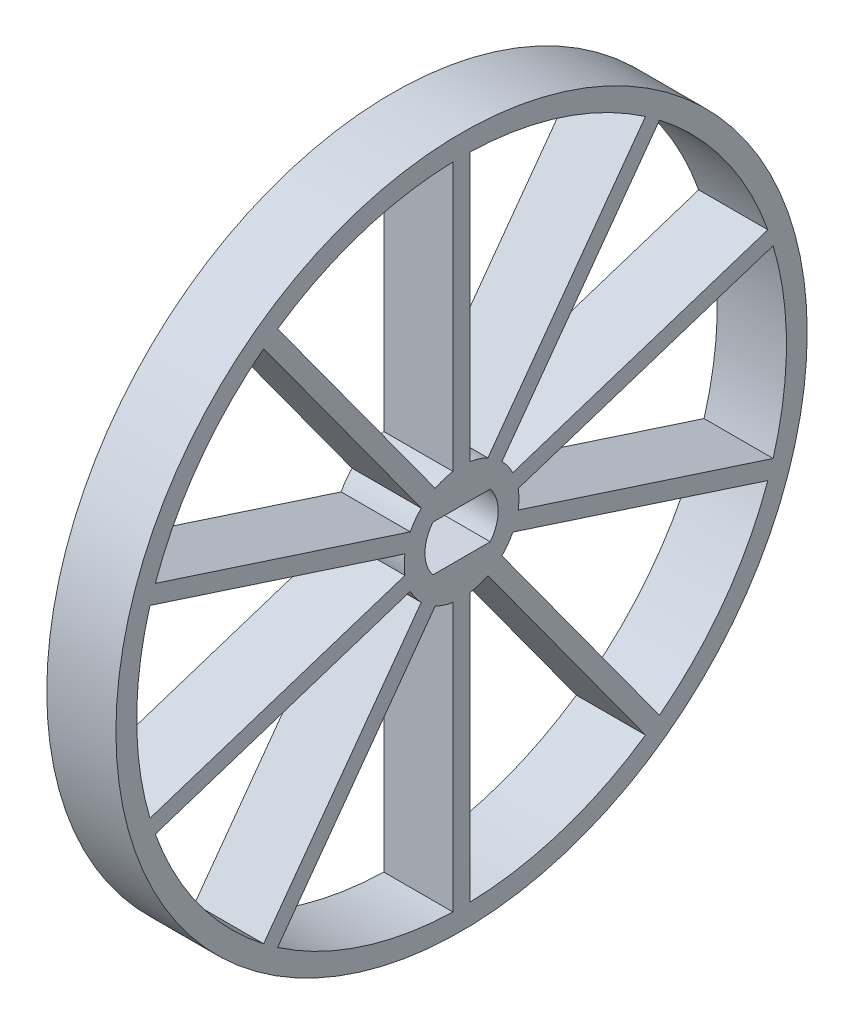
from build123d import *

# Parameters (mm, degrees)
SKETCH1_R           = 25
BOSS_EXTRUDE2_DEPTH = 5


with BuildPart() as part:
    # Sketch1 → Boss-Extrude2 (new body)
    # profile 1 of 38: a face of its own
    with BuildSketch(Plane(origin=(0, 0, 0), x_dir=(0, 0, -1), z_dir=(1, 0, 0))):
        Circle(SKETCH1_R)
        with BuildLine():
            ThreePointArc((-13.30243176, 19.372540083), (-7.261899368, 22.349828133), (-0.625, 23.49168736))
            Line((-0.625, 23.49168736), (-0.625, 23.832616044))
            Line((-0.625, 23.832616044), (0.625, 23.832616044))
            Line((0.625, 23.832616044), (0.625, 23.49168736))
            ThreePointArc((0.625, 23.49168736), (7.261899368, 22.349828133), (13.30243176, 19.372540083))
            Line((13.30243176, 19.372540083), (13.502824613, 19.648357183))
            Line((13.502824613, 19.648357183), (14.514095856, 18.913625618))
            Line((14.514095856, 18.913625618), (14.313703003, 18.637808518))
            ThreePointArc((14.313703003, 18.637808518), (19.011899368, 13.812953429), (22.148786721, 7.853740943))
            Line((22.148786721, 7.853740943), (22.473029168, 7.959093701))
            Line((22.473029168, 7.959093701), (22.859300411, 6.770273055))
            Line((22.859300411, 6.770273055), (22.535057964, 6.664920298))
            ThreePointArc((22.535057964, 6.664920298), (23.257513433, 3.367204913), (23.5, 0))
            ThreePointArc((23.5, 0), (23.257513433, -3.367204913), (22.535057964, -6.664920298))
            Line((22.535057964, -6.664920298), (22.859300411, -6.770273055))
            Line((22.859300411, -6.770273055), (22.473029168, -7.959093701))
            Line((22.473029168, -7.959093701), (22.148786721, -7.853740943))
            ThreePointArc((22.148786721, -7.853740943), (19.011899368, -13.812953429), (14.313703003, -18.637808518))
            Line((14.313703003, -18.637808518), (14.514095856, -18.913625618))
            Line((14.514095856, -18.913625618), (13.502824613, -19.648357183))
            Line((13.502824613, -19.648357183), (13.30243176, -19.372540083))
            ThreePointArc((13.30243176, -19.372540083), (7.261899368, -22.349828133), (0.625, -23.49168736))
            Line((0.625, -23.49168736), (0.625, -23.832616044))
            Line((0.625, -23.832616044), (-0.625, -23.832616044))
            Line((-0.625, -23.832616044), (-0.625, -23.49168736))
            ThreePointArc((-0.625, -23.49168736), (-7.261899368, -22.349828133), (-13.30243176, -19.372540083))
            Line((-13.30243176, -19.372540083), (-13.502824613, -19.648357183))
            Line((-13.502824613, -19.648357183), (-14.514095856, -18.913625618))
            Line((-14.514095856, -18.913625618), (-14.313703003, -18.637808518))
            ThreePointArc((-14.313703003, -18.637808518), (-19.011899368, -13.812953429), (-22.148786721, -7.853740943))
            Line((-22.148786721, -7.853740943), (-22.473029168, -7.959093701))
            Line((-22.473029168, -7.959093701), (-22.859300411, -6.770273055))
            Line((-22.859300411, -6.770273055), (-22.535057964, -6.664920298))
            ThreePointArc((-22.535057964, -6.664920298), (-23.5, 0), (-22.535057964, 6.664920298))
            Line((-22.535057964, 6.664920298), (-22.859300411, 6.770273055))
            Line((-22.859300411, 6.770273055), (-22.473029168, 7.959093701))
            Line((-22.473029168, 7.959093701), (-22.148786721, 7.853740943))
            ThreePointArc((-22.148786721, 7.853740943), (-19.011899368, 13.812953429), (-14.313703003, 18.637808518))
            Line((-14.313703003, 18.637808518), (-14.514095856, 18.913625618))
            Line((-14.514095856, 18.913625618), (-13.502824613, 19.648357183))
            Line((-13.502824613, 19.648357183), (-13.30243176, 19.372540083))
        make_face(mode=Mode.SUBTRACT)
    # profile 2 of 38: a face of its own
    with BuildSketch(Plane(origin=(0, 0, 0), x_dir=(0, 0, -1), z_dir=(1, 0, 0))):
        with BuildLine():
            Line((-0.625, 23.49168736), (-0.625, 4.102666816))
            ThreePointArc((-0.625, 4.102666816), (0, 4.15), (0.625, 4.102666816))
            Line((0.625, 4.102666816), (0.625, 23.49168736))
            ThreePointArc((0.625, 23.49168736), (0, 23.5), (-0.625, 23.49168736))
        make_face()
    # profile 3 of 38: a face of its own
    with BuildSketch(Plane(origin=(0, 0, 0), x_dir=(0, 0, -1), z_dir=(1, 0, 0))):
        with BuildLine():
            Line((-0.625, 23.832616044), (-0.625, 23.49168736))
            ThreePointArc((-0.625, 23.49168736), (0, 23.5), (0.625, 23.49168736))
            Line((0.625, 23.49168736), (0.625, 23.832616044))
            Line((0.625, 23.832616044), (-0.625, 23.832616044))
        make_face()
    # profile 4 of 38: a face of its own
    with BuildSketch(Plane(origin=(0, 0, 0), x_dir=(0, 0, -1), z_dir=(1, 0, 0))):
        with BuildLine():
            ThreePointArc((-14.313703003, 18.637808518), (-13.812953429, 19.011899368), (-13.30243176, 19.372540083))
            Line((-13.30243176, 19.372540083), (-13.502824613, 19.648357183))
            Line((-13.502824613, 19.648357183), (-14.514095856, 18.913625618))
            Line((-14.514095856, 18.913625618), (-14.313703003, 18.637808518))
        make_face()
    # profile 5 of 38: a face of its own
    with BuildSketch(Plane(origin=(0, 0, 0), x_dir=(0, 0, -1), z_dir=(1, 0, 0))):
        with BuildLine():
            ThreePointArc((-2.917122671, 2.951761393), (-2.439308797, 3.357420527), (-1.905851428, 3.686492959))
            Line((-1.905851428, 3.686492959), (-13.30243176, 19.372540083))
            ThreePointArc((-13.30243176, 19.372540083), (-13.812953429, 19.011899368), (-14.313703003, 18.637808518))
            Line((-14.313703003, 18.637808518), (-2.917122671, 2.951761393))
        make_face()
    # profile 6 of 38: a face of its own
    with BuildSketch(Plane(origin=(0, 0, 0), x_dir=(0, 0, -1), z_dir=(1, 0, 0))):
        with BuildLine():
            ThreePointArc((-22.535057964, 6.664920298), (-22.349828133, 7.261899368), (-22.148786721, 7.853740943))
            Line((-22.148786721, 7.853740943), (-22.473029168, 7.959093701))
            Line((-22.473029168, 7.959093701), (-22.859300411, 6.770273055))
            Line((-22.859300411, 6.770273055), (-22.535057964, 6.664920298))
        make_face()
    # profile 7 of 38: a face of its own
    with BuildSketch(Plane(origin=(0, 0, 0), x_dir=(0, 0, -1), z_dir=(1, 0, 0))):
        with BuildLine():
            ThreePointArc((-4.095003631, 0.673383446), (-3.946884543, 1.282420527), (-3.708732388, 1.862204091))
            Line((-3.708732388, 1.862204091), (-22.148786721, 7.853740943))
            ThreePointArc((-22.148786721, 7.853740943), (-22.349828133, 7.261899368), (-22.535057964, 6.664920298))
            Line((-22.535057964, 6.664920298), (-4.095003631, 0.673383446))
        make_face()
    # profile 8 of 38: a face of its own
    with BuildSketch(Plane(origin=(0, 0, 0), x_dir=(0, 0, -1), z_dir=(1, 0, 0))):
        with BuildLine():
            ThreePointArc((-22.148786721, -7.853740943), (-22.349828133, -7.261899368), (-22.535057964, -6.664920298))
            Line((-22.535057964, -6.664920298), (-22.859300411, -6.770273055))
            Line((-22.859300411, -6.770273055), (-22.473029168, -7.959093701))
            Line((-22.473029168, -7.959093701), (-22.148786721, -7.853740943))
        make_face()
    # profile 9 of 38: a face of its own
    with BuildSketch(Plane(origin=(0, 0, 0), x_dir=(0, 0, -1), z_dir=(1, 0, 0))):
        with BuildLine():
            ThreePointArc((-13.30243176, -19.372540083), (-13.812953429, -19.011899368), (-14.313703003, -18.637808518))
            Line((-14.313703003, -18.637808518), (-14.514095856, -18.913625618))
            Line((-14.514095856, -18.913625618), (-13.502824613, -19.648357183))
            Line((-13.502824613, -19.648357183), (-13.30243176, -19.372540083))
        make_face()
    # profile 10 of 38: a face of its own
    with BuildSketch(Plane(origin=(0, 0, 0), x_dir=(0, 0, -1), z_dir=(1, 0, 0))):
        with BuildLine():
            ThreePointArc((-1.905851428, -3.686492959), (-2.439308797, -3.357420527), (-2.917122671, -2.951761393))
            Line((-2.917122671, -2.951761393), (-14.313703003, -18.637808518))
            ThreePointArc((-14.313703003, -18.637808518), (-13.812953429, -19.011899368), (-13.30243176, -19.372540083))
            Line((-13.30243176, -19.372540083), (-1.905851428, -3.686492959))
        make_face()
    # profile 11 of 38: a face of its own
    with BuildSketch(Plane(origin=(0, 0, 0), x_dir=(0, 0, -1), z_dir=(1, 0, 0))):
        with BuildLine():
            ThreePointArc((-3.708732388, -1.862204091), (-3.946884543, -1.282420527), (-4.095003631, -0.673383446))
            Line((-4.095003631, -0.673383446), (-22.535057964, -6.664920298))
            ThreePointArc((-22.535057964, -6.664920298), (-22.349828133, -7.261899368), (-22.148786721, -7.853740943))
            Line((-22.148786721, -7.853740943), (-3.708732388, -1.862204091))
        make_face()
    # profile 12 of 38: a face of its own
    with BuildSketch(Plane(origin=(0, 0, 0), x_dir=(0, 0, -1), z_dir=(1, 0, 0))):
        with BuildLine():
            ThreePointArc((0.625, -23.49168736), (0, -23.5), (-0.625, -23.49168736))
            Line((-0.625, -23.49168736), (-0.625, -23.832616044))
            Line((-0.625, -23.832616044), (0.625, -23.832616044))
            Line((0.625, -23.832616044), (0.625, -23.49168736))
        make_face()
    # profile 13 of 38: a face of its own
    with BuildSketch(Plane(origin=(0, 0, 0), x_dir=(0, 0, -1), z_dir=(1, 0, 0))):
        with BuildLine():
            ThreePointArc((0.625, -4.102666816), (0, -4.15), (-0.625, -4.102666816))
            Line((-0.625, -4.102666816), (-0.625, -23.49168736))
            ThreePointArc((-0.625, -23.49168736), (0, -23.5), (0.625, -23.49168736))
            Line((0.625, -23.49168736), (0.625, -4.102666816))
        make_face()
    # profile 14 of 38: a face of its own
    with BuildSketch(Plane(origin=(0, 0, 0), x_dir=(0, 0, -1), z_dir=(1, 0, 0))):
        with BuildLine():
            Line((14.514095856, -18.913625618), (14.313703003, -18.637808518))
            ThreePointArc((14.313703003, -18.637808518), (13.812953429, -19.011899368), (13.30243176, -19.372540083))
            Line((13.30243176, -19.372540083), (13.502824613, -19.648357183))
            Line((13.502824613, -19.648357183), (14.514095856, -18.913625618))
        make_face()
    # profile 15 of 38: a face of its own
    with BuildSketch(Plane(origin=(0, 0, 0), x_dir=(0, 0, -1), z_dir=(1, 0, 0))):
        with BuildLine():
            Line((14.313703003, -18.637808518), (2.917122671, -2.951761393))
            ThreePointArc((2.917122671, -2.951761393), (2.439308797, -3.357420527), (1.905851428, -3.686492959))
            Line((1.905851428, -3.686492959), (13.30243176, -19.372540083))
            ThreePointArc((13.30243176, -19.372540083), (13.812953429, -19.011899368), (14.313703003, -18.637808518))
        make_face()
    # profile 16 of 38: a face of its own
    with BuildSketch(Plane(origin=(0, 0, 0), x_dir=(0, 0, -1), z_dir=(1, 0, 0))):
        with BuildLine():
            Line((22.859300411, -6.770273055), (22.535057964, -6.664920298))
            ThreePointArc((22.535057964, -6.664920298), (22.349828133, -7.261899368), (22.148786721, -7.853740943))
            Line((22.148786721, -7.853740943), (22.473029168, -7.959093701))
            Line((22.473029168, -7.959093701), (22.859300411, -6.770273055))
        make_face()
    # profile 17 of 38: a face of its own
    with BuildSketch(Plane(origin=(0, 0, 0), x_dir=(0, 0, -1), z_dir=(1, 0, 0))):
        with BuildLine():
            Line((22.535057964, -6.664920298), (4.095003631, -0.673383446))
            ThreePointArc((4.095003631, -0.673383446), (3.946884543, -1.282420527), (3.708732388, -1.862204091))
            Line((3.708732388, -1.862204091), (22.148786721, -7.853740943))
            ThreePointArc((22.148786721, -7.853740943), (22.349828133, -7.261899368), (22.535057964, -6.664920298))
        make_face()
    # profile 18 of 38: a face of its own
    with BuildSketch(Plane(origin=(0, 0, 0), x_dir=(0, 0, -1), z_dir=(1, 0, 0))):
        with BuildLine():
            Line((22.473029168, 7.959093701), (22.148786721, 7.853740943))
            ThreePointArc((22.148786721, 7.853740943), (22.349828133, 7.261899368), (22.535057964, 6.664920298))
            Line((22.535057964, 6.664920298), (22.859300411, 6.770273055))
            Line((22.859300411, 6.770273055), (22.473029168, 7.959093701))
        make_face()
    # profile 19 of 38: a face of its own
    with BuildSketch(Plane(origin=(0, 0, 0), x_dir=(0, 0, -1), z_dir=(1, 0, 0))):
        with BuildLine():
            Line((22.148786721, 7.853740943), (3.708732388, 1.862204091))
            ThreePointArc((3.708732388, 1.862204091), (3.946884543, 1.282420527), (4.095003631, 0.673383446))
            Line((4.095003631, 0.673383446), (22.535057964, 6.664920298))
            ThreePointArc((22.535057964, 6.664920298), (22.349828133, 7.261899368), (22.148786721, 7.853740943))
        make_face()
    # profile 20 of 38: a face of its own
    with BuildSketch(Plane(origin=(0, 0, 0), x_dir=(0, 0, -1), z_dir=(1, 0, 0))):
        with BuildLine():
            Line((13.502824613, 19.648357183), (13.30243176, 19.372540083))
            ThreePointArc((13.30243176, 19.372540083), (13.812953429, 19.011899368), (14.313703003, 18.637808518))
            Line((14.313703003, 18.637808518), (14.514095856, 18.913625618))
            Line((14.514095856, 18.913625618), (13.502824613, 19.648357183))
        make_face()
    # profile 21 of 38: a face of its own
    with BuildSketch(Plane(origin=(0, 0, 0), x_dir=(0, 0, -1), z_dir=(1, 0, 0))):
        with BuildLine():
            Line((13.30243176, 19.372540083), (1.905851428, 3.686492959))
            ThreePointArc((1.905851428, 3.686492959), (2.439308797, 3.357420527), (2.917122671, 2.951761393))
            Line((2.917122671, 2.951761393), (14.313703003, 18.637808518))
            ThreePointArc((14.313703003, 18.637808518), (13.812953429, 19.011899368), (13.30243176, 19.372540083))
        make_face()
    # profile 22 of 38: a face of its own
    with BuildSketch(Plane(origin=(0, 0, 0), x_dir=(0, 0, -1), z_dir=(1, 0, 0))):
        with BuildLine():
            Line((-3.838170085, -0.589933168), (-4.095003631, -0.673383446))
            ThreePointArc((-4.095003631, -0.673383446), (-3.946884543, -1.282420527), (-3.708732388, -1.862204091))
            Line((-3.708732388, -1.862204091), (-3.451898842, -1.778753813))
            Line((-3.451898842, -1.778753813), (-3.838170085, -0.589933168))
        make_face()
    # profile 23 of 38: a face of its own
    with BuildSketch(Plane(origin=(0, 0, 0), x_dir=(0, 0, -1), z_dir=(1, 0, 0))):
        with BuildLine():
            Line((-2.75839081, -2.73328573), (-2.917122671, -2.951761393))
            ThreePointArc((-2.917122671, -2.951761393), (-2.439308797, -3.357420527), (-1.905851428, -3.686492959))
            Line((-1.905851428, -3.686492959), (-1.747119567, -3.468017295))
            Line((-1.747119567, -3.468017295), (-2.75839081, -2.73328573))
        make_face()
    # profile 24 of 38: a face of its own
    with BuildSketch(Plane(origin=(0, 0, 0), x_dir=(0, 0, -1), z_dir=(1, 0, 0))):
        with BuildLine():
            Line((-0.625, -3.832616044), (-0.625, -4.102666816))
            ThreePointArc((-0.625, -4.102666816), (0, -4.15), (0.625, -4.102666816))
            Line((0.625, -4.102666816), (0.625, -3.832616044))
            Line((0.625, -3.832616044), (-0.625, -3.832616044))
        make_face()
    # profile 25 of 38: a face of its own
    with BuildSketch(Plane(origin=(0, 0, 0), x_dir=(0, 0, -1), z_dir=(1, 0, 0))):
        with BuildLine():
            ThreePointArc((1.905851428, -3.686492959), (2.439308797, -3.357420527), (2.917122671, -2.951761393))
            Line((2.917122671, -2.951761393), (2.75839081, -2.73328573))
            Line((2.75839081, -2.73328573), (1.747119567, -3.468017295))
            Line((1.747119567, -3.468017295), (1.905851428, -3.686492959))
        make_face()
    # profile 26 of 38: a face of its own
    with BuildSketch(Plane(origin=(0, 0, 0), x_dir=(0, 0, -1), z_dir=(1, 0, 0))):
        with BuildLine():
            ThreePointArc((3.708732388, -1.862204091), (3.946884543, -1.282420527), (4.095003631, -0.673383446))
            Line((4.095003631, -0.673383446), (3.838170085, -0.589933168))
            Line((3.838170085, -0.589933168), (3.451898842, -1.778753813))
            Line((3.451898842, -1.778753813), (3.708732388, -1.862204091))
        make_face()
    # profile 27 of 38: a face of its own
    with BuildSketch(Plane(origin=(0, 0, 0), x_dir=(0, 0, -1), z_dir=(1, 0, 0))):
        with BuildLine():
            ThreePointArc((4.095003631, 0.673383446), (3.946884543, 1.282420527), (3.708732388, 1.862204091))
            Line((3.708732388, 1.862204091), (3.451898842, 1.778753813))
            Line((3.451898842, 1.778753813), (3.838170085, 0.589933168))
            Line((3.838170085, 0.589933168), (4.095003631, 0.673383446))
        make_face()
    # profile 28 of 38: a face of its own
    with BuildSketch(Plane(origin=(0, 0, 0), x_dir=(0, 0, -1), z_dir=(1, 0, 0))):
        with BuildLine():
            ThreePointArc((2.917122671, 2.951761393), (2.439308797, 3.357420527), (1.905851428, 3.686492959))
            Line((1.905851428, 3.686492959), (1.747119567, 3.468017295))
            Line((1.747119567, 3.468017295), (2.75839081, 2.73328573))
            Line((2.75839081, 2.73328573), (2.917122671, 2.951761393))
        make_face()
    # profile 29 of 38: a face of its own
    with BuildSketch(Plane(origin=(0, 0, 0), x_dir=(0, 0, -1), z_dir=(1, 0, 0))):
        with BuildLine():
            Line((-0.625, 4.102666816), (-0.625, 3.832616044))
            Line((-0.625, 3.832616044), (0.625, 3.832616044))
            Line((0.625, 3.832616044), (0.625, 4.102666816))
            ThreePointArc((0.625, 4.102666816), (0, 4.15), (-0.625, 4.102666816))
        make_face()
    # profile 30 of 38: a face of its own
    with BuildSketch(Plane(origin=(0, 0, 0), x_dir=(0, 0, -1), z_dir=(1, 0, 0))):
        with BuildLine():
            Line((-1.747119567, 3.468017295), (-1.905851428, 3.686492959))
            ThreePointArc((-1.905851428, 3.686492959), (-2.439308797, 3.357420527), (-2.917122671, 2.951761393))
            Line((-2.917122671, 2.951761393), (-2.75839081, 2.73328573))
            Line((-2.75839081, 2.73328573), (-1.747119567, 3.468017295))
        make_face()
    # profile 31 of 38: a face of its own
    with BuildSketch(Plane(origin=(0, 0, 0), x_dir=(0, 0, -1), z_dir=(1, 0, 0))):
        with BuildLine():
            Line((-3.451898842, 1.778753813), (-3.708732388, 1.862204091))
            ThreePointArc((-3.708732388, 1.862204091), (-3.946884543, 1.282420527), (-4.095003631, 0.673383446))
            Line((-4.095003631, 0.673383446), (-3.838170085, 0.589933168))
            Line((-3.838170085, 0.589933168), (-3.451898842, 1.778753813))
        make_face()
    # profile 32 of 38: a face of its own
    with BuildSketch(Plane(origin=(0, 0, 0), x_dir=(0, 0, -1), z_dir=(1, 0, 0))):
        with BuildLine():
            Line((0.625, 3.832616044), (-0.625, 3.832616044))
            Line((-0.625, 3.832616044), (-0.625, 4.102666816))
            ThreePointArc((-0.625, 4.102666816), (-1.282420527, 3.946884543), (-1.905851428, 3.686492959))
            Line((-1.905851428, 3.686492959), (-1.747119567, 3.468017295))
            Line((-1.747119567, 3.468017295), (-2.75839081, 2.73328573))
            Line((-2.75839081, 2.73328573), (-2.917122671, 2.951761393))
            ThreePointArc((-2.917122671, 2.951761393), (-3.357420527, 2.439308797), (-3.708732388, 1.862204091))
            Line((-3.708732388, 1.862204091), (-3.451898842, 1.778753813))
            Line((-3.451898842, 1.778753813), (-3.838170085, 0.589933168))
            Line((-3.838170085, 0.589933168), (-4.095003631, 0.673383446))
            ThreePointArc((-4.095003631, 0.673383446), (-4.15, 0), (-4.095003631, -0.673383446))
            Line((-4.095003631, -0.673383446), (-3.838170085, -0.589933168))
            Line((-3.838170085, -0.589933168), (-3.451898842, -1.778753813))
            Line((-3.451898842, -1.778753813), (-3.708732388, -1.862204091))
            ThreePointArc((-3.708732388, -1.862204091), (-3.357420527, -2.439308797), (-2.917122671, -2.951761393))
            Line((-2.917122671, -2.951761393), (-2.75839081, -2.73328573))
            Line((-2.75839081, -2.73328573), (-1.747119567, -3.468017295))
            Line((-1.747119567, -3.468017295), (-1.905851428, -3.686492959))
            ThreePointArc((-1.905851428, -3.686492959), (-1.282420527, -3.946884543), (-0.625, -4.102666816))
            Line((-0.625, -4.102666816), (-0.625, -3.832616044))
            Line((-0.625, -3.832616044), (0.625, -3.832616044))
            Line((0.625, -3.832616044), (0.625, -4.102666816))
            ThreePointArc((0.625, -4.102666816), (1.282420527, -3.946884543), (1.905851428, -3.686492959))
            Line((1.905851428, -3.686492959), (1.747119567, -3.468017295))
            Line((1.747119567, -3.468017295), (2.75839081, -2.73328573))
            Line((2.75839081, -2.73328573), (2.917122671, -2.951761393))
            ThreePointArc((2.917122671, -2.951761393), (3.357420527, -2.439308797), (3.708732388, -1.862204091))
            Line((3.708732388, -1.862204091), (3.451898842, -1.778753813))
            Line((3.451898842, -1.778753813), (3.838170085, -0.589933168))
            Line((3.838170085, -0.589933168), (4.095003631, -0.673383446))
            ThreePointArc((4.095003631, -0.673383446), (4.136228056, -0.337812768), (4.15, 0))
            ThreePointArc((4.15, 0), (4.136228056, 0.337812768), (4.095003631, 0.673383446))
            Line((4.095003631, 0.673383446), (3.838170085, 0.589933168))
            Line((3.838170085, 0.589933168), (3.451898842, 1.778753813))
            Line((3.451898842, 1.778753813), (3.708732388, 1.862204091))
            ThreePointArc((3.708732388, 1.862204091), (3.357420527, 2.439308797), (2.917122671, 2.951761393))
            Line((2.917122671, 2.951761393), (2.75839081, 2.73328573))
            Line((2.75839081, 2.73328573), (1.747119567, 3.468017295))
            Line((1.747119567, 3.468017295), (1.905851428, 3.686492959))
            ThreePointArc((1.905851428, 3.686492959), (1.282420527, 3.946884543), (0.625, 4.102666816))
            Line((0.625, 4.102666816), (0.625, 3.832616044))
        make_face()
        with BuildLine():
            Line((-2.073644135, -1.65), (-2.65, -1.65))
            Line((-2.65, -1.65), (-2.65, 0))
            Line((-2.65, 0), (-2.65, 1.65))
            Line((-2.65, 1.65), (-2.073644135, 1.65))
            ThreePointArc((-2.073644135, 1.65), (0, 2.65), (2.073644135, 1.65))
            Line((2.073644135, 1.65), (2.65, 1.65))
            Line((2.65, 1.65), (2.65, 0))
            Line((2.65, 0), (2.65, -1.65))
            Line((2.65, -1.65), (2.073644135, -1.65))
            ThreePointArc((2.073644135, -1.65), (0, -2.65), (-2.073644135, -1.65))
        make_face(mode=Mode.SUBTRACT)
    # profile 33 of 38: a face of its own
    with BuildSketch(Plane(origin=(0, 0, 0), x_dir=(0, 0, -1), z_dir=(1, 0, 0))):
        with BuildLine():
            ThreePointArc((2.073644135, 1.65), (2.501765073, 0.873883013), (2.65, 0))
            Line((2.65, 0), (2.65, 1.65))
            Line((2.65, 1.65), (2.073644135, 1.65))
        make_face()
    # profile 34 of 38: a face of its own
    with BuildSketch(Plane(origin=(0, 0, 0), x_dir=(0, 0, -1), z_dir=(1, 0, 0))):
        with BuildLine():
            ThreePointArc((2.65, 0), (2.501765073, -0.873883013), (2.073644135, -1.65))
            Line((2.073644135, -1.65), (2.65, -1.65))
            Line((2.65, -1.65), (2.65, 0))
        make_face()
    # profile 35 of 38: a face of its own
    with BuildSketch(Plane(origin=(0, 0, 0), x_dir=(0, 0, -1), z_dir=(1, 0, 0))):
        with BuildLine():
            Line((2.073644135, -1.65), (-2.073644135, -1.65))
            ThreePointArc((-2.073644135, -1.65), (0, -2.65), (2.073644135, -1.65))
        make_face()
    # profile 36 of 38: a face of its own
    with BuildSketch(Plane(origin=(0, 0, 0), x_dir=(0, 0, -1), z_dir=(1, 0, 0))):
        with BuildLine():
            Line((-2.65, 0), (-2.65, -1.65))
            Line((-2.65, -1.65), (-2.073644135, -1.65))
            ThreePointArc((-2.073644135, -1.65), (-2.501765073, -0.873883013), (-2.65, 0))
        make_face()
    # profile 37 of 38: a face of its own
    with BuildSketch(Plane(origin=(0, 0, 0), x_dir=(0, 0, -1), z_dir=(1, 0, 0))):
        with BuildLine():
            Line((-2.65, 1.65), (-2.65, 0))
            ThreePointArc((-2.65, 0), (-2.501765073, 0.873883013), (-2.073644135, 1.65))
            Line((-2.073644135, 1.65), (-2.65, 1.65))
        make_face()
    # profile 38 of 38: a face of its own
    with BuildSketch(Plane(origin=(0, 0, 0), x_dir=(0, 0, -1), z_dir=(1, 0, 0))):
        with BuildLine():
            ThreePointArc((2.073644135, 1.65), (0, 2.65), (-2.073644135, 1.65))
            Line((-2.073644135, 1.65), (2.073644135, 1.65))
        make_face()
    extrude(amount=BOSS_EXTRUDE2_DEPTH)


solid = part.part
